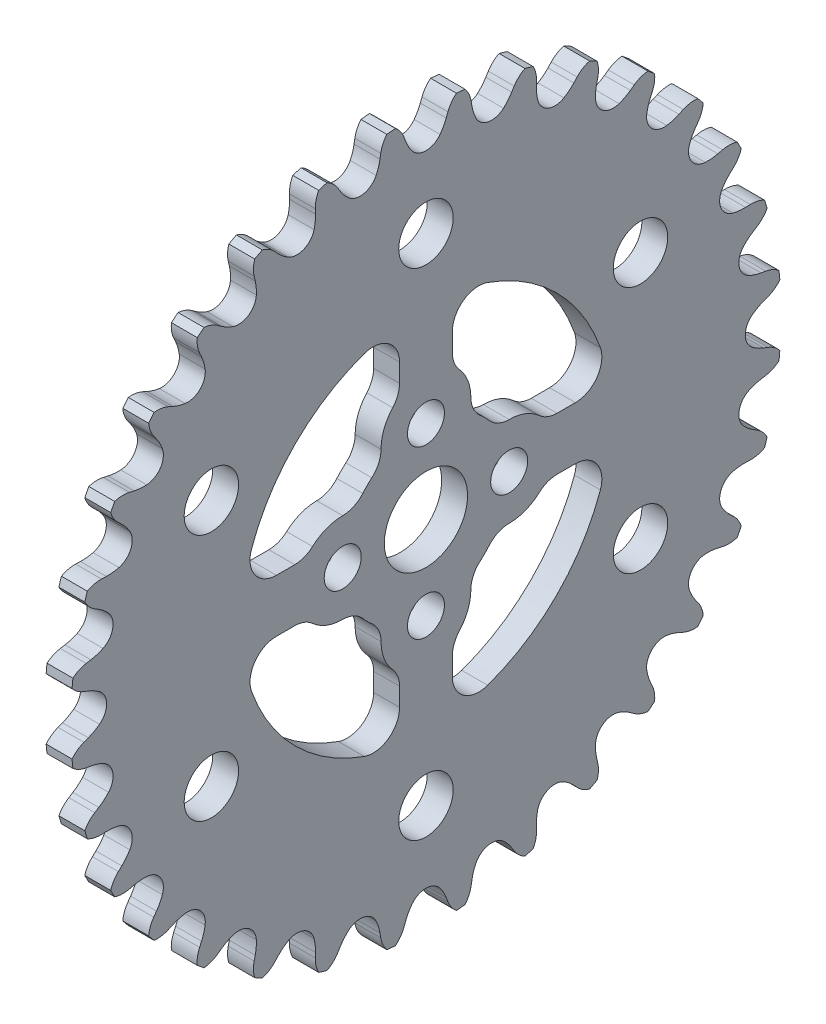
from build123d import *

# Parameters (mm, degrees)
SKETCH1_R           = 4
SKETCH1_R_2         = 1.778
SKETCH1_R_3         = 2.6162
BOSS_EXTRUDE1_DEPTH = 2.4892


with BuildPart() as part:
    # Sketch1 → Boss-Extrude1 (new body)
    with BuildSketch(Plane(origin=(2.4892, 0, 0), x_dir=(0, 0, -1), z_dir=(1, 0, 0))):
        with BuildLine():
            Line((-4.345716952, 32.65669059), (-4.420204549, 32.205525866))
            ThreePointArc((-4.420204549, 32.205525866), (-4.563070636, 31.607573063), (-4.789013227, 31.035814181))
            ThreePointArc((-4.789013227, 31.035814181), (-5.988285488, 30.105144124), (-7.452420596, 30.506029515))
            ThreePointArc((-7.452420596, 30.506029515), (-7.879966983, 30.947801358), (-8.240784667, 31.44556523))
            Line((-8.240784667, 31.44556523), (-8.482255499, 31.833881915))
            ThreePointArc((-8.482255499, 31.833881915), (-8.933516903, 32.380778534), (-9.513125657, 32.789173513))
            ThreePointArc((-9.513125657, 32.789173513), (-9.910700901, 32.671202412), (-10.306813867, 32.548410827))
            ThreePointArc((-10.306813867, 32.548410827), (-10.561848839, 31.886829441), (-10.633219502, 31.181394118))
            Line((-10.633219502, 31.181394118), (-10.61825797, 30.724366589))
            ThreePointArc((-10.61825797, 30.724366589), (-10.64172412, 30.11003149), (-10.751780663, 29.505179581))
            ThreePointArc((-10.751780663, 29.505179581), (-11.746444523, 28.358425677), (-13.260655545, 28.465969579))
            ThreePointArc((-13.260655545, 28.465969579), (-13.766172159, 28.815842737), (-14.217165748, 29.233650177))
            Line((-14.217165748, 29.233650177), (-14.529753612, 29.567396843))
            ThreePointArc((-14.529753612, 29.567396843), (-15.079038392, 30.015748265), (-15.727184035, 30.30321999))
            ThreePointArc((-15.727184035, 30.30321999), (-16.094104962, 30.109952589), (-16.458651278, 29.912242603))
            ThreePointArc((-16.458651278, 29.912242603), (-16.579717699, 29.213618464), (-16.51209339, 28.507814157))
            Line((-16.51209339, 28.507814157), (-16.408257692, 28.062487133))
            ThreePointArc((-16.408257692, 28.062487133), (-16.311422114, 27.455378292), (-16.301363198, 26.840677477))
            ThreePointArc((-16.301363198, 26.840677477), (-17.053194283, 25.521908835), (-18.559290939, 25.331978395))
            ThreePointArc((-18.559290939, 25.331978395), (-19.12335106, 25.576507439), (-19.647189121, 25.898302343))
            Line((-19.647189121, 25.898302343), (-20.018881442, 26.164653293))
            ThreePointArc((-20.018881442, 26.164653293), (-20.645080892, 26.497229623), (-21.336855549, 26.652730717))
            ThreePointArc((-21.336855549, 26.652730717), (-21.659021594, 26.391594173), (-21.97799195, 26.126563671))
            ThreePointArc((-21.97799195, 26.126563671), (-21.960437306, 25.417744511), (-21.75641679, 24.738694885))
            Line((-21.75641679, 24.738694885), (-21.567697273, 24.322182035))
            ThreePointArc((-21.567697273, 24.322182035), (-21.354281304, 23.745630304), (-21.224493487, 23.14470319))
            ThreePointArc((-21.224493487, 23.14470319), (-21.704599349, 21.704599349), (-23.14470319, 21.224493487))
            ThreePointArc((-23.14470319, 21.224493487), (-23.745630304, 21.354281304), (-24.322182035, 21.567697273))
            Line((-24.322182035, 21.567697273), (-24.738694885, 21.75641679))
            ThreePointArc((-24.738694885, 21.75641679), (-25.417744511, 21.960437306), (-26.126563671, 21.97799195))
            ThreePointArc((-26.126563671, 21.97799195), (-26.391594173, 21.659021594), (-26.652730717, 21.336855549))
            ThreePointArc((-26.652730717, 21.336855549), (-26.497229623, 20.645080892), (-26.164653293, 20.018881442))
            Line((-26.164653293, 20.018881442), (-25.898302343, 19.647189121))
            ThreePointArc((-25.898302343, 19.647189121), (-25.576507439, 19.12335106), (-25.331978395, 18.559290939))
            ThreePointArc((-25.331978395, 18.559290939), (-25.521908835, 17.053194283), (-26.840677477, 16.301363198))
            ThreePointArc((-26.840677477, 16.301363198), (-27.455378292, 16.311422114), (-28.062487133, 16.408257692))
            Line((-28.062487133, 16.408257692), (-28.507814157, 16.51209339))
            ThreePointArc((-28.507814157, 16.51209339), (-29.213618464, 16.579717699), (-29.912242603, 16.458651278))
            ThreePointArc((-29.912242603, 16.458651278), (-30.109952589, 16.094104962), (-30.30321999, 15.727184035))
            ThreePointArc((-30.30321999, 15.727184035), (-30.015748265, 15.079038392), (-29.567396843, 14.529753612))
            Line((-29.567396843, 14.529753612), (-29.233650177, 14.217165748))
            ThreePointArc((-29.233650177, 14.217165748), (-28.815842737, 13.766172159), (-28.465969579, 13.260655545))
            ThreePointArc((-28.465969579, 13.260655545), (-28.358425677, 11.746444523), (-29.505179581, 10.751780663))
            ThreePointArc((-29.505179581, 10.751780663), (-30.11003149, 10.64172412), (-30.724366589, 10.61825797))
            Line((-30.724366589, 10.61825797), (-31.181394118, 10.633219502))
            ThreePointArc((-31.181394118, 10.633219502), (-31.886829441, 10.561848839), (-32.548410827, 10.306813867))
            ThreePointArc((-32.548410827, 10.306813867), (-32.671202412, 9.910700901), (-32.789173513, 9.513125657))
            ThreePointArc((-32.789173513, 9.513125657), (-32.380778534, 8.933516903), (-31.833881915, 8.482255499))
            Line((-31.833881915, 8.482255499), (-31.44556523, 8.240784667))
            ThreePointArc((-31.44556523, 8.240784667), (-30.947801358, 7.879966983), (-30.506029515, 7.452420596))
            ThreePointArc((-30.506029515, 7.452420596), (-30.105144124, 5.988285488), (-31.035814181, 4.789013227))
            ThreePointArc((-31.035814181, 4.789013227), (-31.607573063, 4.563070636), (-32.205525866, 4.420204549))
            Line((-32.205525866, 4.420204549), (-32.65669059, 4.345716952))
            ThreePointArc((-32.65669059, 4.345716952), (-33.334647446, 4.138094052), (-33.933761875, 3.758891379))
            ThreePointArc((-33.933761875, 3.758891379), (-33.976916249, 3.346434163), (-34.015057486, 2.933483196))
            ThreePointArc((-34.015057486, 2.933483196), (-33.501433643, 2.44468537), (-32.877008757, 2.108789064))
            Line((-32.877008757, 2.108789064), (-32.449044846, 1.947714854))
            ThreePointArc((-32.449044846, 1.947714854), (-31.890453329, 1.690939094), (-31.373759846, 1.357793302))
            ThreePointArc((-31.373759846, 1.357793302), (-30.694938766, 0), (-31.373759846, -1.357793302))
            ThreePointArc((-31.373759846, -1.357793302), (-31.890453329, -1.690939094), (-32.449044846, -1.947714854))
            Line((-32.449044846, -1.947714854), (-32.877008757, -2.108789064))
            ThreePointArc((-32.877008757, -2.108789064), (-33.501433643, -2.44468537), (-34.015057486, -2.933483196))
            ThreePointArc((-34.015057486, -2.933483196), (-33.976916249, -3.346434163), (-33.933761875, -3.758891379))
            ThreePointArc((-33.933761875, -3.758891379), (-33.334647446, -4.138094052), (-32.65669059, -4.345716952))
            Line((-32.65669059, -4.345716952), (-32.205525866, -4.420204549))
            ThreePointArc((-32.205525866, -4.420204549), (-31.607573063, -4.563070636), (-31.035814181, -4.789013227))
            ThreePointArc((-31.035814181, -4.789013227), (-30.105144124, -5.988285488), (-30.506029515, -7.452420596))
            ThreePointArc((-30.506029515, -7.452420596), (-30.947801358, -7.879966983), (-31.44556523, -8.240784667))
            Line((-31.44556523, -8.240784667), (-31.833881915, -8.482255499))
            ThreePointArc((-31.833881915, -8.482255499), (-32.380778534, -8.933516903), (-32.789173513, -9.513125657))
            ThreePointArc((-32.789173513, -9.513125657), (-32.671202412, -9.910700901), (-32.548410827, -10.306813867))
            ThreePointArc((-32.548410827, -10.306813867), (-31.886829441, -10.561848839), (-31.181394118, -10.633219502))
            Line((-31.181394118, -10.633219502), (-30.724366589, -10.61825797))
            ThreePointArc((-30.724366589, -10.61825797), (-30.11003149, -10.64172412), (-29.505179581, -10.751780663))
            ThreePointArc((-29.505179581, -10.751780663), (-28.358425677, -11.746444523), (-28.465969579, -13.260655545))
            ThreePointArc((-28.465969579, -13.260655545), (-28.815842737, -13.766172159), (-29.233650177, -14.217165748))
            Line((-29.233650177, -14.217165748), (-29.567396843, -14.529753612))
            ThreePointArc((-29.567396843, -14.529753612), (-30.015748265, -15.079038392), (-30.30321999, -15.727184035))
            ThreePointArc((-30.30321999, -15.727184035), (-30.109952589, -16.094104962), (-29.912242603, -16.458651278))
            ThreePointArc((-29.912242603, -16.458651278), (-29.213618464, -16.579717699), (-28.507814157, -16.51209339))
            Line((-28.507814157, -16.51209339), (-28.062487133, -16.408257692))
            ThreePointArc((-28.062487133, -16.408257692), (-27.455378292, -16.311422114), (-26.840677477, -16.301363198))
            ThreePointArc((-26.840677477, -16.301363198), (-25.521908835, -17.053194283), (-25.331978395, -18.559290939))
            ThreePointArc((-25.331978395, -18.559290939), (-25.576507439, -19.12335106), (-25.898302343, -19.647189121))
            Line((-25.898302343, -19.647189121), (-26.164653293, -20.018881442))
            ThreePointArc((-26.164653293, -20.018881442), (-26.497229623, -20.645080892), (-26.652730717, -21.336855549))
            ThreePointArc((-26.652730717, -21.336855549), (-26.391594173, -21.659021594), (-26.126563671, -21.97799195))
            ThreePointArc((-26.126563671, -21.97799195), (-25.417744511, -21.960437306), (-24.738694885, -21.75641679))
            Line((-24.738694885, -21.75641679), (-24.322182035, -21.567697273))
            ThreePointArc((-24.322182035, -21.567697273), (-23.745630304, -21.354281304), (-23.14470319, -21.224493487))
            ThreePointArc((-23.14470319, -21.224493487), (-21.704599349, -21.704599349), (-21.224493487, -23.14470319))
            ThreePointArc((-21.224493487, -23.14470319), (-21.354281304, -23.745630304), (-21.567697273, -24.322182035))
            Line((-21.567697273, -24.322182035), (-21.75641679, -24.738694885))
            ThreePointArc((-21.75641679, -24.738694885), (-21.960437306, -25.417744511), (-21.97799195, -26.126563671))
            ThreePointArc((-21.97799195, -26.126563671), (-21.659021594, -26.391594173), (-21.336855549, -26.652730717))
            ThreePointArc((-21.336855549, -26.652730717), (-20.645080892, -26.497229623), (-20.018881442, -26.164653293))
            Line((-20.018881442, -26.164653293), (-19.647189121, -25.898302343))
            ThreePointArc((-19.647189121, -25.898302343), (-19.12335106, -25.576507439), (-18.559290939, -25.331978395))
            ThreePointArc((-18.559290939, -25.331978395), (-17.053194283, -25.521908835), (-16.301363198, -26.840677477))
            ThreePointArc((-16.301363198, -26.840677477), (-16.311422114, -27.455378292), (-16.408257692, -28.062487133))
            Line((-16.408257692, -28.062487133), (-16.51209339, -28.507814157))
            ThreePointArc((-16.51209339, -28.507814157), (-16.579717699, -29.213618464), (-16.458651278, -29.912242603))
            ThreePointArc((-16.458651278, -29.912242603), (-16.094104962, -30.109952589), (-15.727184035, -30.30321999))
            ThreePointArc((-15.727184035, -30.30321999), (-15.079038392, -30.015748265), (-14.529753612, -29.567396843))
            Line((-14.529753612, -29.567396843), (-14.217165748, -29.233650177))
            ThreePointArc((-14.217165748, -29.233650177), (-13.766172159, -28.815842737), (-13.260655545, -28.465969579))
            ThreePointArc((-13.260655545, -28.465969579), (-11.746444523, -28.358425677), (-10.751780663, -29.505179581))
            ThreePointArc((-10.751780663, -29.505179581), (-10.64172412, -30.11003149), (-10.61825797, -30.724366589))
            Line((-10.61825797, -30.724366589), (-10.633219502, -31.181394118))
            ThreePointArc((-10.633219502, -31.181394118), (-10.561848839, -31.886829441), (-10.306813867, -32.548410827))
            ThreePointArc((-10.306813867, -32.548410827), (-9.910700901, -32.671202412), (-9.513125657, -32.789173513))
            ThreePointArc((-9.513125657, -32.789173513), (-8.933516903, -32.380778534), (-8.482255499, -31.833881915))
            Line((-8.482255499, -31.833881915), (-8.240784667, -31.44556523))
            ThreePointArc((-8.240784667, -31.44556523), (-7.879966983, -30.947801358), (-7.452420596, -30.506029515))
            ThreePointArc((-7.452420596, -30.506029515), (-5.988285488, -30.105144124), (-4.789013227, -31.035814181))
            ThreePointArc((-4.789013227, -31.035814181), (-4.563070636, -31.607573063), (-4.420204549, -32.205525866))
            Line((-4.420204549, -32.205525866), (-4.345716952, -32.65669059))
            ThreePointArc((-4.345716952, -32.65669059), (-4.138094052, -33.334647446), (-3.758891379, -33.933761875))
            ThreePointArc((-3.758891379, -33.933761875), (-3.346434163, -33.976916249), (-2.933483196, -34.015057486))
            ThreePointArc((-2.933483196, -34.015057486), (-2.44468537, -33.501433643), (-2.108789064, -32.877008757))
            Line((-2.108789064, -32.877008757), (-1.947714854, -32.449044846))
            ThreePointArc((-1.947714854, -32.449044846), (-1.690939094, -31.890453329), (-1.357793302, -31.373759846))
            ThreePointArc((-1.357793302, -31.373759846), (0, -30.694938766), (1.357793302, -31.373759846))
            ThreePointArc((1.357793302, -31.373759846), (1.690939094, -31.890453329), (1.947714854, -32.449044846))
            Line((1.947714854, -32.449044846), (2.108789064, -32.877008757))
            ThreePointArc((2.108789064, -32.877008757), (2.44468537, -33.501433643), (2.933483196, -34.015057486))
            ThreePointArc((2.933483196, -34.015057486), (3.346434163, -33.976916249), (3.758891379, -33.933761875))
            ThreePointArc((3.758891379, -33.933761875), (4.138094052, -33.334647446), (4.345716952, -32.65669059))
            Line((4.345716952, -32.65669059), (4.420204549, -32.205525866))
            ThreePointArc((4.420204549, -32.205525866), (4.563070636, -31.607573063), (4.789013227, -31.035814181))
            ThreePointArc((4.789013227, -31.035814181), (5.988285488, -30.105144124), (7.452420596, -30.506029515))
            ThreePointArc((7.452420596, -30.506029515), (7.879966983, -30.947801358), (8.240784667, -31.44556523))
            Line((8.240784667, -31.44556523), (8.482255499, -31.833881915))
            ThreePointArc((8.482255499, -31.833881915), (8.933516903, -32.380778534), (9.513125657, -32.789173513))
            ThreePointArc((9.513125657, -32.789173513), (9.910700901, -32.671202412), (10.306813867, -32.548410827))
            ThreePointArc((10.306813867, -32.548410827), (10.561848839, -31.886829441), (10.633219502, -31.181394118))
            Line((10.633219502, -31.181394118), (10.61825797, -30.724366589))
            ThreePointArc((10.61825797, -30.724366589), (10.64172412, -30.11003149), (10.751780663, -29.505179581))
            ThreePointArc((10.751780663, -29.505179581), (11.746444523, -28.358425677), (13.260655545, -28.465969579))
            ThreePointArc((13.260655545, -28.465969579), (13.766172159, -28.815842737), (14.217165748, -29.233650177))
            Line((14.217165748, -29.233650177), (14.529753612, -29.567396843))
            ThreePointArc((14.529753612, -29.567396843), (15.079038392, -30.015748265), (15.727184035, -30.30321999))
            ThreePointArc((15.727184035, -30.30321999), (16.094104962, -30.109952589), (16.458651278, -29.912242603))
            ThreePointArc((16.458651278, -29.912242603), (16.579717699, -29.213618464), (16.51209339, -28.507814157))
            Line((16.51209339, -28.507814157), (16.408257692, -28.062487133))
            ThreePointArc((16.408257692, -28.062487133), (16.311422114, -27.455378292), (16.301363198, -26.840677477))
            ThreePointArc((16.301363198, -26.840677477), (17.053194283, -25.521908835), (18.559290939, -25.331978395))
            ThreePointArc((18.559290939, -25.331978395), (19.12335106, -25.576507439), (19.647189121, -25.898302343))
            Line((19.647189121, -25.898302343), (20.018881442, -26.164653293))
            ThreePointArc((20.018881442, -26.164653293), (20.645080892, -26.497229623), (21.336855549, -26.652730717))
            ThreePointArc((21.336855549, -26.652730717), (21.659021594, -26.391594173), (21.97799195, -26.126563671))
            ThreePointArc((21.97799195, -26.126563671), (21.960437306, -25.417744511), (21.75641679, -24.738694885))
            Line((21.75641679, -24.738694885), (21.567697273, -24.322182035))
            ThreePointArc((21.567697273, -24.322182035), (21.354281304, -23.745630304), (21.224493487, -23.14470319))
            ThreePointArc((21.224493487, -23.14470319), (21.704599349, -21.704599349), (23.14470319, -21.224493487))
            ThreePointArc((23.14470319, -21.224493487), (23.745630304, -21.354281304), (24.322182035, -21.567697273))
            Line((24.322182035, -21.567697273), (24.738694885, -21.75641679))
            ThreePointArc((24.738694885, -21.75641679), (25.417744511, -21.960437306), (26.126563671, -21.97799195))
            ThreePointArc((26.126563671, -21.97799195), (26.391594173, -21.659021594), (26.652730717, -21.336855549))
            ThreePointArc((26.652730717, -21.336855549), (26.497229623, -20.645080892), (26.164653293, -20.018881442))
            Line((26.164653293, -20.018881442), (25.898302343, -19.647189121))
            ThreePointArc((25.898302343, -19.647189121), (25.576507439, -19.12335106), (25.331978395, -18.559290939))
            ThreePointArc((25.331978395, -18.559290939), (25.521908835, -17.053194283), (26.840677477, -16.301363198))
            ThreePointArc((26.840677477, -16.301363198), (27.455378292, -16.311422114), (28.062487133, -16.408257692))
            Line((28.062487133, -16.408257692), (28.507814157, -16.51209339))
            ThreePointArc((28.507814157, -16.51209339), (29.213618464, -16.579717699), (29.912242603, -16.458651278))
            ThreePointArc((29.912242603, -16.458651278), (30.109952589, -16.094104962), (30.30321999, -15.727184035))
            ThreePointArc((30.30321999, -15.727184035), (30.015748265, -15.079038392), (29.567396843, -14.529753612))
            Line((29.567396843, -14.529753612), (29.233650177, -14.217165748))
            ThreePointArc((29.233650177, -14.217165748), (28.815842737, -13.766172159), (28.465969579, -13.260655545))
            ThreePointArc((28.465969579, -13.260655545), (28.358425677, -11.746444523), (29.505179581, -10.751780663))
            ThreePointArc((29.505179581, -10.751780663), (30.11003149, -10.64172412), (30.724366589, -10.61825797))
            Line((30.724366589, -10.61825797), (31.181394118, -10.633219502))
            ThreePointArc((31.181394118, -10.633219502), (31.886829441, -10.561848839), (32.548410827, -10.306813867))
            ThreePointArc((32.548410827, -10.306813867), (32.671202412, -9.910700901), (32.789173513, -9.513125657))
            ThreePointArc((32.789173513, -9.513125657), (32.380778534, -8.933516903), (31.833881915, -8.482255499))
            Line((31.833881915, -8.482255499), (31.44556523, -8.240784667))
            ThreePointArc((31.44556523, -8.240784667), (30.947801358, -7.879966983), (30.506029515, -7.452420596))
            ThreePointArc((30.506029515, -7.452420596), (30.105144124, -5.988285488), (31.035814181, -4.789013227))
            ThreePointArc((31.035814181, -4.789013227), (31.607573063, -4.563070636), (32.205525866, -4.420204549))
            Line((32.205525866, -4.420204549), (32.65669059, -4.345716952))
            ThreePointArc((32.65669059, -4.345716952), (33.334647446, -4.138094052), (33.933761875, -3.758891379))
            ThreePointArc((33.933761875, -3.758891379), (33.976916249, -3.346434163), (34.015057486, -2.933483196))
            ThreePointArc((34.015057486, -2.933483196), (33.501433643, -2.44468537), (32.877008757, -2.108789064))
            Line((32.877008757, -2.108789064), (32.449044846, -1.947714854))
            ThreePointArc((32.449044846, -1.947714854), (31.890453329, -1.690939094), (31.373759846, -1.357793302))
            ThreePointArc((31.373759846, -1.357793302), (30.694938766, 0), (31.373759846, 1.357793302))
            ThreePointArc((31.373759846, 1.357793302), (31.890453329, 1.690939094), (32.449044846, 1.947714854))
            Line((32.449044846, 1.947714854), (32.877008757, 2.108789064))
            ThreePointArc((32.877008757, 2.108789064), (33.501433643, 2.44468537), (34.015057486, 2.933483196))
            ThreePointArc((34.015057486, 2.933483196), (33.976916249, 3.346434163), (33.933761875, 3.758891379))
            ThreePointArc((33.933761875, 3.758891379), (33.334647446, 4.138094052), (32.65669059, 4.345716952))
            Line((32.65669059, 4.345716952), (32.205525866, 4.420204549))
            ThreePointArc((32.205525866, 4.420204549), (31.607573063, 4.563070636), (31.035814181, 4.789013227))
            ThreePointArc((31.035814181, 4.789013227), (30.105144124, 5.988285488), (30.506029515, 7.452420596))
            ThreePointArc((30.506029515, 7.452420596), (30.947801358, 7.879966983), (31.44556523, 8.240784667))
            Line((31.44556523, 8.240784667), (31.833881915, 8.482255499))
            ThreePointArc((31.833881915, 8.482255499), (32.380778534, 8.933516903), (32.789173513, 9.513125657))
            ThreePointArc((32.789173513, 9.513125657), (32.671202412, 9.910700901), (32.548410827, 10.306813867))
            ThreePointArc((32.548410827, 10.306813867), (31.886829441, 10.561848839), (31.181394118, 10.633219502))
            Line((31.181394118, 10.633219502), (30.724366589, 10.61825797))
            ThreePointArc((30.724366589, 10.61825797), (30.11003149, 10.64172412), (29.505179581, 10.751780663))
            ThreePointArc((29.505179581, 10.751780663), (28.358425677, 11.746444523), (28.465969579, 13.260655545))
            ThreePointArc((28.465969579, 13.260655545), (28.815842737, 13.766172159), (29.233650177, 14.217165748))
            Line((29.233650177, 14.217165748), (29.567396843, 14.529753612))
            ThreePointArc((29.567396843, 14.529753612), (30.015748265, 15.079038392), (30.30321999, 15.727184035))
            ThreePointArc((30.30321999, 15.727184035), (30.109952589, 16.094104962), (29.912242603, 16.458651278))
            ThreePointArc((29.912242603, 16.458651278), (29.213618464, 16.579717699), (28.507814157, 16.51209339))
            Line((28.507814157, 16.51209339), (28.062487133, 16.408257692))
            ThreePointArc((28.062487133, 16.408257692), (27.455378292, 16.311422114), (26.840677477, 16.301363198))
            ThreePointArc((26.840677477, 16.301363198), (25.521908835, 17.053194283), (25.331978395, 18.559290939))
            ThreePointArc((25.331978395, 18.559290939), (25.576507439, 19.12335106), (25.898302343, 19.647189121))
            Line((25.898302343, 19.647189121), (26.164653293, 20.018881442))
            ThreePointArc((26.164653293, 20.018881442), (26.497229623, 20.645080892), (26.652730717, 21.336855549))
            ThreePointArc((26.652730717, 21.336855549), (26.391594173, 21.659021594), (26.126563671, 21.97799195))
            ThreePointArc((26.126563671, 21.97799195), (25.417744511, 21.960437306), (24.738694885, 21.75641679))
            Line((24.738694885, 21.75641679), (24.322182035, 21.567697273))
            ThreePointArc((24.322182035, 21.567697273), (23.745630304, 21.354281304), (23.14470319, 21.224493487))
            ThreePointArc((23.14470319, 21.224493487), (21.704599349, 21.704599349), (21.224493487, 23.14470319))
            ThreePointArc((21.224493487, 23.14470319), (21.354281304, 23.745630304), (21.567697273, 24.322182035))
            Line((21.567697273, 24.322182035), (21.75641679, 24.738694885))
            ThreePointArc((21.75641679, 24.738694885), (21.960437306, 25.417744511), (21.97799195, 26.126563671))
            ThreePointArc((21.97799195, 26.126563671), (21.659021594, 26.391594173), (21.336855549, 26.652730717))
            ThreePointArc((21.336855549, 26.652730717), (20.645080892, 26.497229623), (20.018881442, 26.164653293))
            Line((20.018881442, 26.164653293), (19.647189121, 25.898302343))
            ThreePointArc((19.647189121, 25.898302343), (19.12335106, 25.576507439), (18.559290939, 25.331978395))
            ThreePointArc((18.559290939, 25.331978395), (17.053194283, 25.521908835), (16.301363198, 26.840677477))
            ThreePointArc((16.301363198, 26.840677477), (16.311422114, 27.455378292), (16.408257692, 28.062487133))
            Line((16.408257692, 28.062487133), (16.51209339, 28.507814157))
            ThreePointArc((16.51209339, 28.507814157), (16.579717699, 29.213618464), (16.458651278, 29.912242603))
            ThreePointArc((16.458651278, 29.912242603), (16.094104962, 30.109952589), (15.727184035, 30.30321999))
            ThreePointArc((15.727184035, 30.30321999), (15.079038392, 30.015748265), (14.529753612, 29.567396843))
            Line((14.529753612, 29.567396843), (14.217165748, 29.233650177))
            ThreePointArc((14.217165748, 29.233650177), (13.766172159, 28.815842737), (13.260655545, 28.465969579))
            ThreePointArc((13.260655545, 28.465969579), (11.746444523, 28.358425677), (10.751780663, 29.505179581))
            ThreePointArc((10.751780663, 29.505179581), (10.64172412, 30.11003149), (10.61825797, 30.724366589))
            Line((10.61825797, 30.724366589), (10.633219502, 31.181394118))
            ThreePointArc((10.633219502, 31.181394118), (10.561848839, 31.886829441), (10.306813867, 32.548410827))
            ThreePointArc((10.306813867, 32.548410827), (9.910700901, 32.671202412), (9.513125657, 32.789173513))
            ThreePointArc((9.513125657, 32.789173513), (8.933516903, 32.380778534), (8.482255499, 31.833881915))
            Line((8.482255499, 31.833881915), (8.240784667, 31.44556523))
            ThreePointArc((8.240784667, 31.44556523), (7.879966983, 30.947801358), (7.452420596, 30.506029515))
            ThreePointArc((7.452420596, 30.506029515), (5.988285488, 30.105144124), (4.789013227, 31.035814181))
            ThreePointArc((4.789013227, 31.035814181), (4.563070636, 31.607573063), (4.420204549, 32.205525866))
            Line((4.420204549, 32.205525866), (4.345716952, 32.65669059))
            ThreePointArc((4.345716952, 32.65669059), (4.138094052, 33.334647446), (3.758891379, 33.933761875))
            ThreePointArc((3.758891379, 33.933761875), (3.346434163, 33.976916249), (2.933483196, 34.015057486))
            ThreePointArc((2.933483196, 34.015057486), (2.44468537, 33.501433643), (2.108789064, 32.877008757))
            Line((2.108789064, 32.877008757), (1.947714854, 32.449044846))
            ThreePointArc((1.947714854, 32.449044846), (1.690939094, 31.890453329), (1.357793302, 31.373759846))
            ThreePointArc((1.357793302, 31.373759846), (0, 30.694938766), (-1.357793302, 31.373759846))
            ThreePointArc((-1.357793302, 31.373759846), (-1.690939094, 31.890453329), (-1.947714854, 32.449044846))
            Line((-1.947714854, 32.449044846), (-2.108789064, 32.877008757))
            ThreePointArc((-2.108789064, 32.877008757), (-2.44468537, 33.501433643), (-2.933483196, 34.015057486))
            ThreePointArc((-2.933483196, 34.015057486), (-3.346434163, 33.976916249), (-3.758891379, 33.933761875))
            ThreePointArc((-3.758891379, 33.933761875), (-4.138094052, 33.334647446), (-4.345716952, 32.65669059))
        make_face()
        with Locations(Location((0, 0, 0), (0, 0, 180))):
            Circle(SKETCH1_R, mode=Mode.SUBTRACT)
        with Locations(Location((0, 8, 0), (0, 0, 180))):
            Circle(SKETCH1_R_2, mode=Mode.SUBTRACT)
        with Locations(Location((8, 0, 0), (0, 0, 180))):
            Circle(SKETCH1_R_2, mode=Mode.SUBTRACT)
        with Locations(Location((0, -8, 0), (0, 0, 180))):
            Circle(SKETCH1_R_2, mode=Mode.SUBTRACT)
        with Locations(Location((-8, 0, 0), (0, 0, 180))):
            Circle(SKETCH1_R_2, mode=Mode.SUBTRACT)
        with Locations(Location((0, 23.8125, 0), (0, 0, 180))):
            Circle(SKETCH1_R_3, mode=Mode.SUBTRACT)
        with Locations(Location((20.622229928, 11.90625, 0), (0, 0, 180))):
            Circle(SKETCH1_R_3, mode=Mode.SUBTRACT)
        with Locations(Location((20.622229928, -11.90625, 0), (0, 0, 180))):
            Circle(SKETCH1_R_3, mode=Mode.SUBTRACT)
        with Locations(Location((0, -23.8125, 0), (0, 0, 180))):
            Circle(SKETCH1_R_3, mode=Mode.SUBTRACT)
        with Locations(Location((-20.622229928, -11.90625, 0), (0, 0, 180))):
            Circle(SKETCH1_R_3, mode=Mode.SUBTRACT)
        with Locations(Location((-20.622229928, 11.90625, 0), (0, 0, 180))):
            Circle(SKETCH1_R_3, mode=Mode.SUBTRACT)
        with BuildLine():
            Line((12.607142715, -2.54), (14.368409794, -2.54))
            ThreePointArc((14.368409794, -2.54), (16.442311109, -3.613530316), (16.763144759, -5.926666667))
            ThreePointArc((16.763144759, -5.926666667), (12.572358569, -12.572358569), (5.926666667, -16.763144759))
            ThreePointArc((5.926666667, -16.763144759), (3.613530316, -16.442311109), (2.54, -14.368409794))
            Line((2.54, -14.368409794), (2.54, -12.607142715))
            ThreePointArc((2.54, -12.607142715), (2.710341484, -11.692638195), (3.198518519, -10.900793562))
            ThreePointArc((3.198518519, -10.900793562), (4.027998276, -9.555748659), (4.317999367, -8.002338917))
            ThreePointArc((4.317999367, -8.002338917), (4.550752819, -6.941540052), (5.205312329, -6.074925806))
            ThreePointArc((5.205312329, -6.074925806), (5.656854249, -5.656854249), (6.074925806, -5.205312329))
            ThreePointArc((6.074925806, -5.205312329), (6.941540052, -4.550752819), (8.002338917, -4.317999367))
            ThreePointArc((8.002338917, -4.317999367), (9.555748659, -4.027998276), (10.900793562, -3.198518519))
            ThreePointArc((10.900793562, -3.198518519), (11.692638195, -2.710341484), (12.607142715, -2.54))
        make_face(mode=Mode.SUBTRACT)
        with BuildLine():
            Line((-14.368409794, -2.54), (-12.607142715, -2.54))
            ThreePointArc((-12.607142715, -2.54), (-11.692638195, -2.710341484), (-10.900793562, -3.198518519))
            ThreePointArc((-10.900793562, -3.198518519), (-9.555748659, -4.027998276), (-8.002338917, -4.317999367))
            ThreePointArc((-8.002338917, -4.317999367), (-6.941540052, -4.550752819), (-6.074925806, -5.205312329))
            ThreePointArc((-6.074925806, -5.205312329), (-5.656854249, -5.656854249), (-5.205312329, -6.074925806))
            ThreePointArc((-5.205312329, -6.074925806), (-4.550752819, -6.941540052), (-4.317999367, -8.002338917))
            ThreePointArc((-4.317999367, -8.002338917), (-4.027998276, -9.555748659), (-3.198518519, -10.900793562))
            ThreePointArc((-3.198518519, -10.900793562), (-2.710341484, -11.692638195), (-2.54, -12.607142715))
            Line((-2.54, -12.607142715), (-2.54, -14.368409794))
            ThreePointArc((-2.54, -14.368409794), (-3.613530316, -16.442311109), (-5.926666667, -16.763144759))
            ThreePointArc((-5.926666667, -16.763144759), (-12.572358569, -12.572358569), (-16.763144759, -5.926666667))
            ThreePointArc((-16.763144759, -5.926666667), (-16.442311109, -3.613530316), (-14.368409794, -2.54))
        make_face(mode=Mode.SUBTRACT)
        with BuildLine():
            Line((14.368409794, 2.54), (12.607142715, 2.54))
            ThreePointArc((12.607142715, 2.54), (11.692638195, 2.710341484), (10.900793562, 3.198518519))
            ThreePointArc((10.900793562, 3.198518519), (9.555748659, 4.027998276), (8.002338917, 4.317999367))
            ThreePointArc((8.002338917, 4.317999367), (6.941540052, 4.550752819), (6.074925806, 5.205312329))
            ThreePointArc((6.074925806, 5.205312329), (5.656854249, 5.656854249), (5.205312329, 6.074925806))
            ThreePointArc((5.205312329, 6.074925806), (4.550752819, 6.941540052), (4.317999367, 8.002338917))
            ThreePointArc((4.317999367, 8.002338917), (4.027998276, 9.555748659), (3.198518519, 10.900793562))
            ThreePointArc((3.198518519, 10.900793562), (2.710341484, 11.692638195), (2.54, 12.607142715))
            Line((2.54, 12.607142715), (2.54, 14.368409794))
            ThreePointArc((2.54, 14.368409794), (3.613530316, 16.442311109), (5.926666667, 16.763144759))
            ThreePointArc((5.926666667, 16.763144759), (12.572358569, 12.572358569), (16.763144759, 5.926666667))
            ThreePointArc((16.763144759, 5.926666667), (16.442311109, 3.613530316), (14.368409794, 2.54))
        make_face(mode=Mode.SUBTRACT)
        with BuildLine():
            Line((-12.607142715, 2.54), (-14.368409794, 2.54))
            ThreePointArc((-14.368409794, 2.54), (-16.442311109, 3.613530316), (-16.763144759, 5.926666667))
            ThreePointArc((-16.763144759, 5.926666667), (-12.572358569, 12.572358569), (-5.926666667, 16.763144759))
            ThreePointArc((-5.926666667, 16.763144759), (-3.613530316, 16.442311109), (-2.54, 14.368409794))
            Line((-2.54, 14.368409794), (-2.54, 12.607142715))
            ThreePointArc((-2.54, 12.607142715), (-2.710341484, 11.692638195), (-3.198518519, 10.900793562))
            ThreePointArc((-3.198518519, 10.900793562), (-4.027998276, 9.555748659), (-4.317999367, 8.002338917))
            ThreePointArc((-4.317999367, 8.002338917), (-4.550752819, 6.941540052), (-5.205312329, 6.074925806))
            ThreePointArc((-5.205312329, 6.074925806), (-5.656854249, 5.656854249), (-6.074925806, 5.205312329))
            ThreePointArc((-6.074925806, 5.205312329), (-6.941540052, 4.550752819), (-8.002338917, 4.317999367))
            ThreePointArc((-8.002338917, 4.317999367), (-9.555748659, 4.027998276), (-10.900793562, 3.198518519))
            ThreePointArc((-10.900793562, 3.198518519), (-11.692638195, 2.710341484), (-12.607142715, 2.54))
        make_face(mode=Mode.SUBTRACT)
    extrude(amount=-BOSS_EXTRUDE1_DEPTH)


solid = part.part
